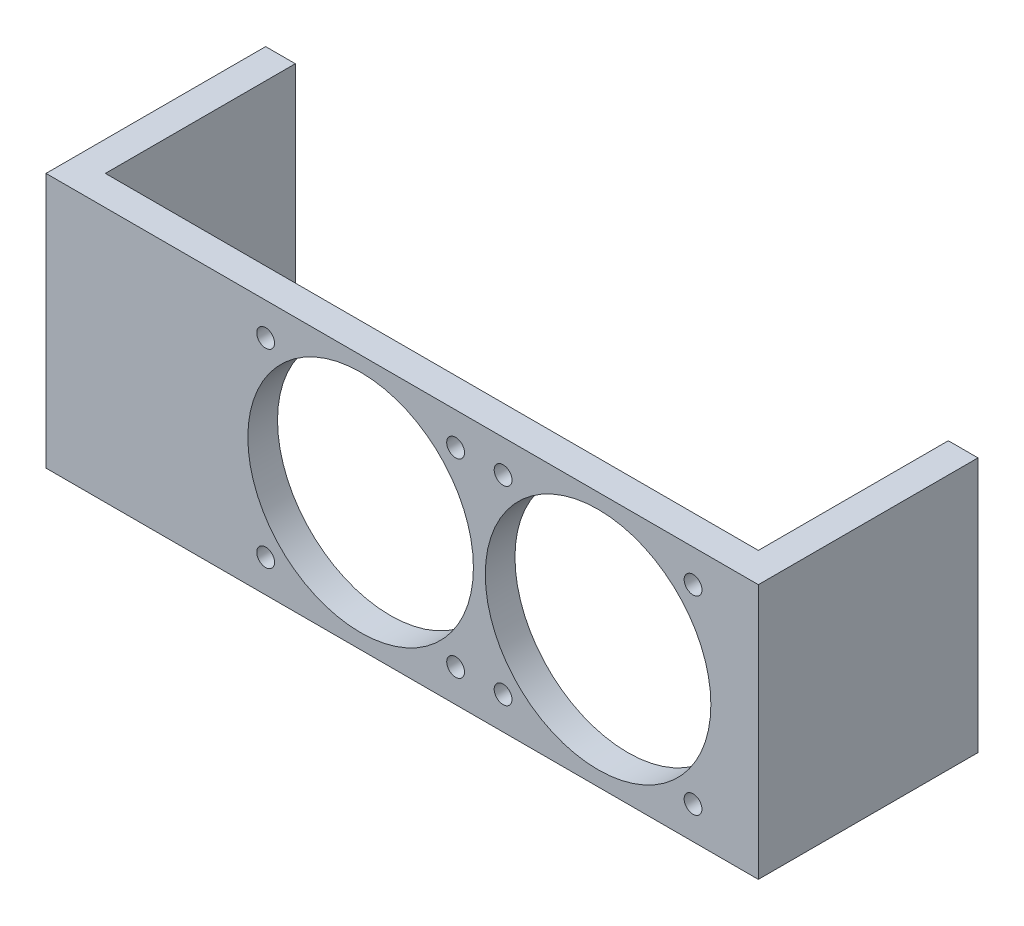
from build123d import *

# Parameters (mm, degrees)
SKETCH_1_W      = 110
SKETCH_1_H      = 43
SKETCH_1_R      = 19
SKETCH_1_R_2    = 1.5
EXTRUDE_2_DEPTH = 5
SKETCH_2_W      = 5
SKETCH_2_H      = 43
EXTRUDE_4_DEPTH = 37


with BuildPart() as part:
    # 草图1 → 凸台-拉伸2 (new body)
    with BuildSketch(Plane.XY):
        with Locations((25.61465721, 4.254137116)):
            Rectangle(SKETCH_1_W, SKETCH_1_H)
        with Locations((58.61465721, 4.254137116)):
            Circle(SKETCH_1_R, mode=Mode.SUBTRACT)
        with Locations((74.61465721, 20.254137116)):
            Circle(SKETCH_1_R_2, mode=Mode.SUBTRACT)
        with Locations((74.61465721, -11.745862884)):
            Circle(SKETCH_1_R_2, mode=Mode.SUBTRACT)
        with Locations((42.61465721, -11.745862884)):
            Circle(SKETCH_1_R_2, mode=Mode.SUBTRACT)
        with Locations((42.61465721, 20.254137116)):
            Circle(SKETCH_1_R_2, mode=Mode.SUBTRACT)
        with Locations((34.61465721, -11.745862884)):
            Circle(SKETCH_1_R_2, mode=Mode.SUBTRACT)
        with Locations((2.61465721, -11.745862884)):
            Circle(SKETCH_1_R_2, mode=Mode.SUBTRACT)
        with Locations((2.61465721, 20.254137116)):
            Circle(SKETCH_1_R_2, mode=Mode.SUBTRACT)
        with Locations((34.61465721, 20.254137116)):
            Circle(SKETCH_1_R_2, mode=Mode.SUBTRACT)
        with Locations((18.61465721, 4.254137116)):
            Circle(SKETCH_1_R, mode=Mode.SUBTRACT)
    extrude(amount=EXTRUDE_2_DEPTH)

    # 草图2 → 凸台-拉伸4 (add)
    with BuildSketch(Plane.XY.offset(5)):
        with Locations((83.11465721, 4.254137116)):
            Rectangle(SKETCH_2_W, SKETCH_2_H)
        with Locations((-31.88534279, 4.254137116)):
            Rectangle(SKETCH_2_W, SKETCH_2_H)
    extrude(amount=-EXTRUDE_4_DEPTH)


solid = part.part
